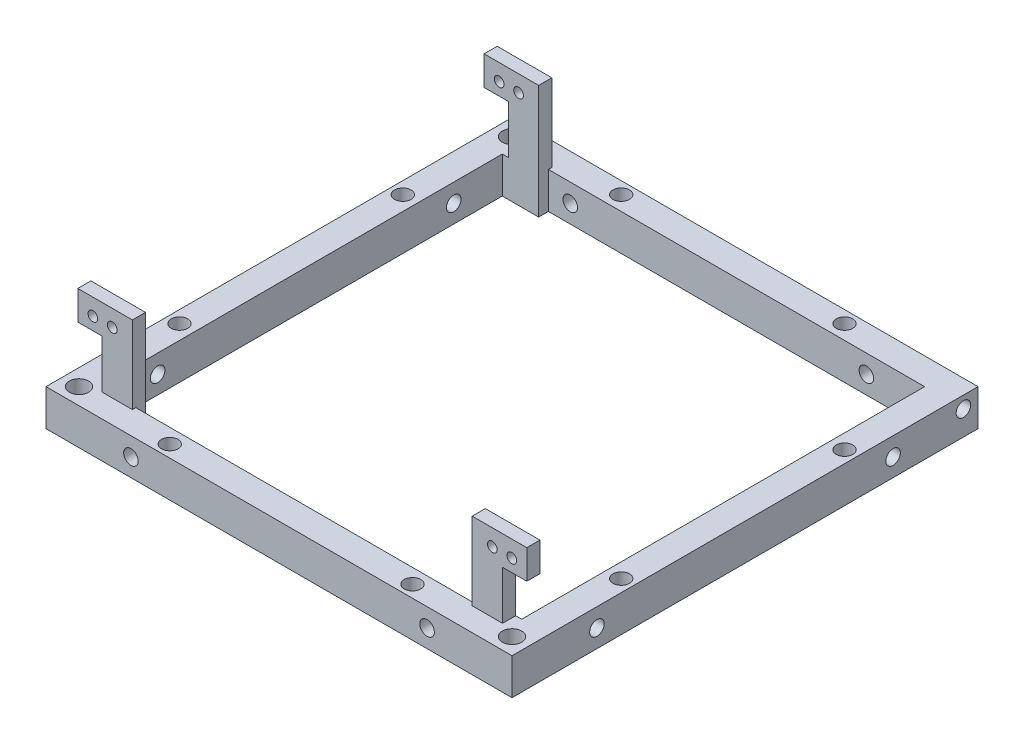
from build123d import *
from build123d.topology import SkipClean

# Parameters (mm, degrees)
SKETCH1_W                       = 96
SKETCH1_H                       = 96
SKETCH1_W_2                     = 80
SKETCH1_H_2                     = 80
BOSS_EXTRUDE1_DEPTH             = 8
SKETCH27_W                      = 82
SKETCH27_H                      = 82
CUT_EXTRUDE2_DEPTH              = 10
F_3_0_3_DIAMETER_HOLE1_D        = 3
F_3_4_3_4_DIAMETER_HOLE1_D      = 3.4
SKETCH38_W                      = 85
SKETCH38_H                      = 85
CUT_EXTRUDE4_DEPTH              = 10
F_3_0_3_DIAMETER_HOLE7_D        = 3
SKETCH44_W                      = 4
SKETCH44_H                      = 4
BOSS_EXTRUDE2_DEPTH             = 8
SKETCH45_W                      = 4
SKETCH45_H                      = 3.5
BOSS_EXTRUDE3_DEPTH             = 8
SKETCH49_W                      = 96
SKETCH49_H                      = 1.5
CUT_EXTRUDE5_DEPTH              = 146
TAP_DRILL_FOR_M4_TAP1_D         = 4
SKETCH53_W                      = 4
SKETCH53_H                      = 6.5
BOSS_EXTRUDE5_DEPTH             = 78
SKETCH57_W                      = 4
SKETCH57_H                      = 6.5
CUT_EXTRUDE6_DEPTH              = 7.5
SKETCH58_W                      = 4
SKETCH58_H                      = 6.5
BOSS_EXTRUDE7_DEPTH             = 81
SKETCH61_W                      = 32
SKETCH61_H                      = 85
CUT_EXTRUDE7_DEPTH              = 81
SKETCH66_W                      = 85
SKETCH66_H                      = 80.198
CUT_EXTRUDE8_DEPTH              = 10
SKETCH67_W                      = 85
SKETCH67_H                      = 85
CUT_EXTRUDE9_DEPTH              = 3.5
SKETCH68_W                      = 52
SKETCH68_H                      = 85
CUT_EXTRUDE10_DEPTH             = 56
SKETCH54_W                      = 6.25
SKETCH54_H                      = 2.7
BOSS_EXTRUDE8_DEPTH             = 16
CUT_EXTRUDE12_START             = -10.22
SKETCH75_W                      = 2.401
SKETCH75_H                      = 3
CUT_EXTRUDE12_DEPTH             = 72.44
SKETCH77_W                      = 2.401
SKETCH77_H                      = 3
CUT_EXTRUDE13_DEPTH             = 6.28
SKETCH78_W                      = 85
SKETCH78_H                      = 85
CUT_EXTRUDE14_DEPTH             = 6.5
SKETCH79_W                      = 85
SKETCH79_H                      = 85
SKETCH79_W_2                    = 81
SKETCH79_H_2                    = 81
BOSS_EXTRUDE12_DEPTH            = 6.5
SKETCH81_W                      = 2.7
SKETCH81_H                      = 6
BOSS_EXTRUDE13_DEPTH            = 5
TAP_DRILL_FOR_M2_TAP1_D         = 2
TAP_DRILL_FOR_M2_TAP1_DEPTH     = 5.5
TAP_DRILL_FOR_M2_TAP2_D         = 2
TAP_DRILL_FOR_M2_TAP2_DEPTH     = 5.5
TAP_DRILL_FOR_M3X0_5_TAP1_D     = 3
TAP_DRILL_FOR_M3X0_5_TAP1_DEPTH = 7.5
SKETCH88_W                      = 2
SKETCH88_H                      = 70
SKETCH88_W_2                    = 70
SKETCH88_H_2                    = 2
CUT_EXTRUDE15_DEPTH             = 10
SKETCH89_W                      = 85
SKETCH89_H                      = 81
CUT_EXTRUDE16_DEPTH             = 10
SKETCH90_W                      = 2
SKETCH90_H                      = 6.5
CUT_EXTRUDE17_DEPTH             = 7.5
SKETCH91_W                      = 96
SKETCH91_H                      = 96
SKETCH91_R                      = 1.7
SKETCH91_R_2                    = 1.64536441
SKETCH91_R_3                    = 2
BOSS_EXTRUDE14_DEPTH            = 1


with BuildPart() as part:
    # Sketch1 → Boss-Extrude1 (new body)
    with BuildSketch(Plane(origin=(0, 0, 0), x_dir=(1, 0, 0), z_dir=(0, 1, 0))):
        Rectangle(SKETCH1_W, SKETCH1_H)
        Rectangle(SKETCH1_W_2, SKETCH1_H_2, mode=Mode.SUBTRACT)
    extrude(amount=BOSS_EXTRUDE1_DEPTH)

    # Sketch27 → Cut-Extrude2 (cut)
    with BuildSketch(Plane(origin=(0, 8, 0), x_dir=(1, 0, 0), z_dir=(0, 1, 0))):
        Rectangle(SKETCH27_W, SKETCH27_H)
    extrude(amount=-CUT_EXTRUDE2_DEPTH, mode=Mode.SUBTRACT)

    # Ø3.0 (3) Diameter Hole1 (through all)
    with Locations(Plane.XY.offset(48)):
        with Locations((-30.5, 2.7), (30.5, 2.7)):
            Hole(F_3_0_3_DIAMETER_HOLE1_D / 2)

    # Ø3.4 (3.4) Diameter Hole1 (through all)
    with Locations(Plane(origin=(0, 0, 0), x_dir=(-1, 0, 0), z_dir=(0, -1, 0))):
        with Locations((-23, 45.5), (23, 45.5), (45.5, 23), (45.5, -23), (25, -45.5), (-25, -45.5), (-45.5, -23), (-45.5, 23)):
            Hole(F_3_4_3_4_DIAMETER_HOLE1_D / 2)

    # Sketch38 → Cut-Extrude4 (cut)
    with BuildSketch(Plane(origin=(0, 8, 0), x_dir=(1, 0, 0), z_dir=(0, 1, 0))):
        Rectangle(SKETCH38_W, SKETCH38_H)
    extrude(amount=-CUT_EXTRUDE4_DEPTH, mode=Mode.SUBTRACT)

    # Ø3.0 (3) Diameter Hole7 (through all)
    with Locations(Plane.ZY.offset(48)):
        with Locations((-30.5, 2.7), (30.5, 2.7)):
            Hole(F_3_0_3_DIAMETER_HOLE7_D / 2)

    # Sketch44 → Boss-Extrude2 (add)
    with BuildSketch(Plane.XZ):
        with Locations((40.5, -40.5)):
            Rectangle(SKETCH44_W, SKETCH44_H)
        with Locations((-40.5, -40.5)):
            Rectangle(SKETCH44_W, SKETCH44_H)
        with Locations((-40.5, 40.5)):
            Rectangle(SKETCH44_W, SKETCH44_H)
        with Locations((40.5, 40.5)):
            Rectangle(SKETCH44_W, SKETCH44_H)
    extrude(amount=-BOSS_EXTRUDE2_DEPTH)

    # Sketch45 → Boss-Extrude3 (add)
    with BuildSketch(Plane(origin=(0, 8, 0), x_dir=(1, 0, 0), z_dir=(0, 1, 0))):
        with Locations((-40.5, 36.75)):
            Rectangle(SKETCH45_W, SKETCH45_H)
    extrude(amount=-BOSS_EXTRUDE3_DEPTH)

    # Sketch49 → Cut-Extrude5 (cut)
    with BuildSketch(Plane(origin=(48, 0, 0), x_dir=(0, 0, -1), z_dir=(1, 0, 0))):
        with Locations((0, 7.25)):
            Rectangle(SKETCH49_W, SKETCH49_H)
    extrude(amount=-CUT_EXTRUDE5_DEPTH, mode=Mode.SUBTRACT)

    # Tap Drill for M4 Tap1 (through all)
    with Locations(Plane(origin=(0, 6.5, 0), x_dir=(1, 0, 0), z_dir=(0, 1, 0))):
        with Locations((44.6, -44.6), (-44.6, -44.6), (-44.6, 44.6)):
            Hole(TAP_DRILL_FOR_M4_TAP1_D / 2)

    # Sketch53 → Boss-Extrude5 (add)
    with BuildSketch(Plane(origin=(-38.5, 0, 0), x_dir=(0, 0, -1), z_dir=(1, 0, 0))):
        with Locations((-40.5, 3.25)):
            Rectangle(SKETCH53_W, SKETCH53_H)
    extrude(amount=BOSS_EXTRUDE5_DEPTH)

    # Sketch57 → Cut-Extrude6 (cut)
    with BuildSketch(Plane.XY.offset(-35)):
        with Locations((-40.5, 3.25)):
            Rectangle(SKETCH57_W, SKETCH57_H)
    extrude(amount=-CUT_EXTRUDE6_DEPTH, mode=Mode.SUBTRACT)

    # Sketch58 → Boss-Extrude7 (add)
    with BuildSketch(Plane.ZY.offset(-38.5)):
        with Locations((-40.5, 3.25)):
            Rectangle(SKETCH58_W, SKETCH58_H)
    extrude(amount=BOSS_EXTRUDE7_DEPTH)

    # Sketch61 → Cut-Extrude7 (cut)
    with BuildSketch(Plane(origin=(0, 6.5, 0), x_dir=(1, 0, 0), z_dir=(0, 1, 0))):
        Rectangle(SKETCH61_W, SKETCH61_H)
    extrude(amount=-CUT_EXTRUDE7_DEPTH, mode=Mode.SUBTRACT)

    # Sketch66 → Cut-Extrude8 (cut)
    with BuildSketch(Plane(origin=(0, 6.5, 0), x_dir=(1, 0, 0), z_dir=(0, 1, 0))):
        Rectangle(SKETCH66_W, SKETCH66_H)
    extrude(amount=-CUT_EXTRUDE8_DEPTH, mode=Mode.SUBTRACT)

    # Sketch67 → Cut-Extrude9 (cut)
    with BuildSketch(Plane.XZ):
        Rectangle(SKETCH67_W, SKETCH67_H)
    extrude(amount=-CUT_EXTRUDE9_DEPTH, mode=Mode.SUBTRACT)

    # Sketch68 → Cut-Extrude10 (cut)
    with BuildSketch(Plane(origin=(0, 6.5, 0), x_dir=(1, 0, 0), z_dir=(0, 1, 0))):
        Rectangle(SKETCH68_W, SKETCH68_H)
    extrude(amount=-CUT_EXTRUDE10_DEPTH, mode=Mode.SUBTRACT)

    # Sketch54 → Boss-Extrude8 (add)
    with BuildSketch(Plane(origin=(0, 6.5, 0), x_dir=(1, 0, 0), z_dir=(0, 1, 0))):
        with Locations((-38.125, -41.85)):
            Rectangle(SKETCH54_W, SKETCH54_H)
    boss_extrude8 = extrude(amount=BOSS_EXTRUDE8_DEPTH)

    # Mirror1: Boss-Extrude8 across plane
    add(boss_extrude8.mirror(Plane(origin=(0, 0, 0), x_dir=(0, 0, 1), z_dir=(1, 0, 0))))

    # Sketch75 → Cut-Extrude12 (cut)
    with BuildSketch(Plane.ZY.offset(-26).offset(CUT_EXTRUDE12_START)):
        with Locations((41.2995, 5)):
            Rectangle(SKETCH75_W, SKETCH75_H)
    cut_extrude12 = extrude(amount=CUT_EXTRUDE12_DEPTH, mode=Mode.SUBTRACT)

    # Mirror2: Boss-Extrude8 across plane
    add(boss_extrude8.mirror(Plane.XY))

    # Mirror3: Cut-Extrude12 across plane
    add(cut_extrude12.mirror(Plane.XY), mode=Mode.SUBTRACT)

    # Sketch77 → Cut-Extrude13 (cut)
    with BuildSketch(Plane.ZY.offset(-36.22)):
        with Locations((-41.2995, 5)):
            Rectangle(SKETCH77_W, SKETCH77_H)
    extrude(amount=-CUT_EXTRUDE13_DEPTH, mode=Mode.SUBTRACT)

    # Sketch78 → Cut-Extrude14 (cut)
    with BuildSketch(Plane.XZ):
        Rectangle(SKETCH78_W, SKETCH78_H)
    extrude(amount=-CUT_EXTRUDE14_DEPTH, mode=Mode.SUBTRACT)

    # Sketch79 → Boss-Extrude12 (add)
    with BuildSketch(Plane.XZ):
        Rectangle(SKETCH79_W, SKETCH79_H)
        Rectangle(SKETCH79_W_2, SKETCH79_H_2, mode=Mode.SUBTRACT)
    extrude(amount=-BOSS_EXTRUDE12_DEPTH)

    # Sketch81 → Boss-Extrude13 (add)
    with BuildSketch(Plane.ZY.offset(41.25)):
        with Locations((41.85, 19.5)):
            Rectangle(SKETCH81_W, SKETCH81_H)
    boss_extrude13 = extrude(amount=BOSS_EXTRUDE13_DEPTH)

    # Mirror4: Boss-Extrude13 across plane
    add(boss_extrude13.mirror(Plane.XY))

    # Mirror5: Boss-Extrude13 across plane
    add(boss_extrude13.mirror(Plane(origin=(0, 0, 0), x_dir=(0, 0, 1), z_dir=(1, 0, 0))))

    # Tap Drill for M2 Tap1
    with Locations(Plane(origin=(0, 0, 40.5), x_dir=(-1, 0, 0), z_dir=(0, 0, -1))):
        with Locations((39.147345831, 19.1), (43.147345831, 19.1), (-39.15, 19.1), (-43.15, 19.1)):
            Hole(TAP_DRILL_FOR_M2_TAP1_D / 2, depth=TAP_DRILL_FOR_M2_TAP1_DEPTH)

    # Tap Drill for M2 Tap2
    with Locations(Plane.XY.offset(-40.5)):
        with Locations((-39.147345831, 19.1), (-43.147345831, 19.1)):
            Hole(TAP_DRILL_FOR_M2_TAP2_D / 2, depth=TAP_DRILL_FOR_M2_TAP2_DEPTH)

    # Tap Drill for M3x0.5 Tap1
    with Locations(Plane(origin=(48, 0, 0), x_dir=(0, 0, -1), z_dir=(1, 0, 0))):
        with Locations((45, 4)):
            Hole(TAP_DRILL_FOR_M3X0_5_TAP1_D / 2, depth=TAP_DRILL_FOR_M3X0_5_TAP1_DEPTH)

    # Sketch88 → Cut-Extrude15 (cut)
    with BuildSketch(Plane(origin=(0, 6.5, 0), x_dir=(1, 0, 0), z_dir=(0, 1, 0))):
        with Locations((41.5, 0)):
            Rectangle(SKETCH88_W, SKETCH88_H)
        with Locations((0, -41.5)):
            Rectangle(SKETCH88_W_2, SKETCH88_H_2)
        with Locations((-41.5, 0)):
            Rectangle(SKETCH88_W, SKETCH88_H)
        with Locations((0, 41.5)):
            Rectangle(SKETCH88_W_2, SKETCH88_H_2)
    extrude(amount=-CUT_EXTRUDE15_DEPTH, mode=Mode.SUBTRACT)

    # Sketch89 → Cut-Extrude16 (cut)
    with BuildSketch(Plane(origin=(0, 6.5, 0), x_dir=(1, 0, 0), z_dir=(0, 1, 0))):
        Rectangle(SKETCH89_W, SKETCH89_H)
    extrude(amount=-CUT_EXTRUDE16_DEPTH, mode=Mode.SUBTRACT)

    # Sketch90 → Cut-Extrude17 (cut)
    with BuildSketch(Plane.ZY.offset(-35)):
        with Locations((-41.5, 3.25)):
            Rectangle(SKETCH90_W, SKETCH90_H)
    extrude(amount=-CUT_EXTRUDE17_DEPTH, mode=Mode.SUBTRACT)

    # Sketch91 → Boss-Extrude14 (add)
    with SkipClean():  # the faces are left unmerged after this step: merging them gives an invalid solid
        with BuildSketch(Plane.XZ):
            Rectangle(SKETCH91_W, SKETCH91_H)
            with Locations(Location((-25, 45.5, 0), (0, 0, 270))):
                Circle(SKETCH91_R, mode=Mode.SUBTRACT)
            with Locations(Location((25, 45.5, 0), (0, 0, 270))):
                Circle(SKETCH91_R_2, mode=Mode.SUBTRACT)
            with Locations(Location((44.6, 44.6, 0), (0, 0, 90))):
                Circle(SKETCH91_R_3, mode=Mode.SUBTRACT)
            with Locations(Location((45.5, 23, 0), (0, 0, 270))):
                Circle(SKETCH91_R, mode=Mode.SUBTRACT)
            with Locations(Location((45.5, -23, 0), (0, 0, 270))):
                Circle(SKETCH91_R, mode=Mode.SUBTRACT)
            with Locations(Location((23, -45.5, 0), (0, 0, 270))):
                Circle(SKETCH91_R, mode=Mode.SUBTRACT)
            with Locations(Location((-23, -45.5, 0), (0, 0, 270))):
                Circle(SKETCH91_R, mode=Mode.SUBTRACT)
            with Locations(Location((-45.5, -23, 0), (0, 0, 270))):
                Circle(SKETCH91_R, mode=Mode.SUBTRACT)
            with Locations(Location((-44.6, -44.6, 0), (0, 0, 90))):
                Circle(SKETCH91_R_3, mode=Mode.SUBTRACT)
            with Locations(Location((-45.5, 23, 0), (0, 0, 270))):
                Circle(SKETCH91_R, mode=Mode.SUBTRACT)
            with Locations(Location((-44.6, 44.6, 0), (0, 0, 90))):
                Circle(SKETCH91_R_3, mode=Mode.SUBTRACT)
            Polygon((42.5, -42.5), (-35, -42.5), (-35, -40.5), (-42.5, -40.5), (-42.5, 40.5), (-35, 40.5), (-35, 42.5), (35, 42.5), (35, 40.5), (42.5, 40.5), align=None, mode=Mode.SUBTRACT)
        extrude(amount=BOSS_EXTRUDE14_DEPTH)


solid = part.part
